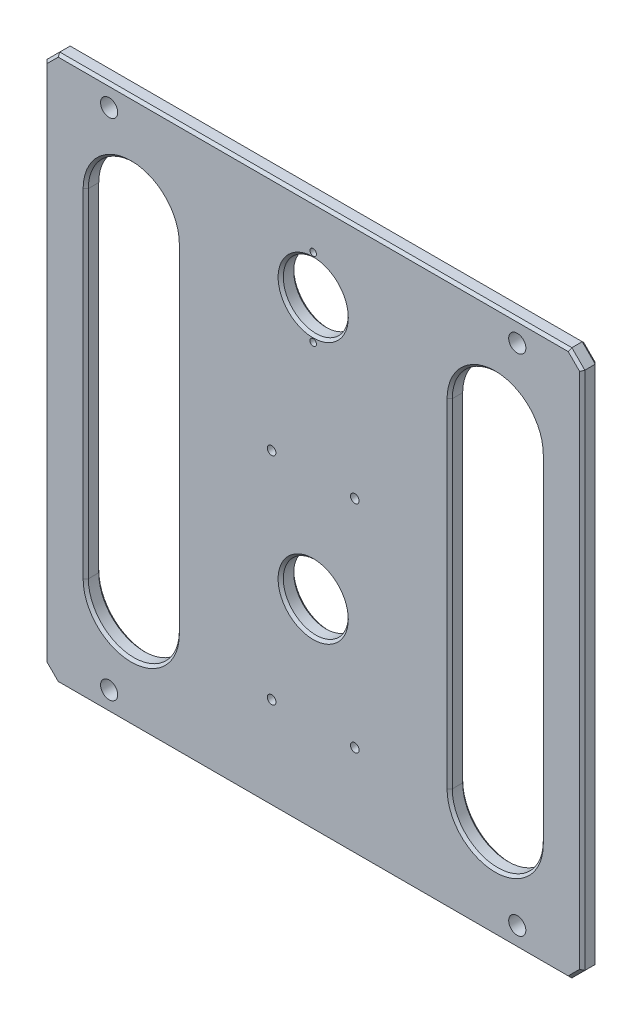
from build123d import *

# Parameters (mm, degrees)
SKETCH_1_W             = 207
SKETCH_1_H             = 210
EXTRUDE_1_DEPTH        = 6
SKETCH_2_R             = 3.3
CUT_EXTRUDE_1_DEPTH    = 148.557615866
CHAMFER_2_SIZE         = 5
CHAMFER_1_SIZE         = 1
HOLE_WIZARD_M4_1_D     = 3.3
HOLE_WIZARD_M4_1_DEPTH = 10.1
HOLE_WIZARD_M4_1_TIP   = 0.991420021
HOLE_WIZARD_M3_1_D     = 2.5
HOLE_WIZARD_M3_1_DEPTH = 7.5
HOLE_WIZARD_M3_1_TIP   = 0.751075774
SKETCH_7_R             = 12.5
CUT_EXTRUDE_2_DEPTH    = 148.557615866
SKETCH_8_R             = 12.5
CUT_EXTRUDE_3_DEPTH    = 148.557615866
CUT_EXTRUDE_4_DEPTH    = 148.557615866
CHAMFER_3_SIZE         = 1


with BuildPart() as part:
    # 草图1 → 凸台-拉伸1 (new body)
    with BuildSketch(Plane.XY):
        Rectangle(SKETCH_1_W, SKETCH_1_H)
    extrude(amount=EXTRUDE_1_DEPTH)

    # 草图2 → 切除-拉伸1 (cut, through all)
    with BuildSketch(Plane.XY.offset(6)):
        with Locations((-78.5, 97)):
            Circle(SKETCH_2_R)
        with Locations((78.5, 97)):
            Circle(SKETCH_2_R)
        with Locations((-78.5, -97)):
            Circle(SKETCH_2_R)
        with Locations((78.5, -97)):
            Circle(SKETCH_2_R)
    extrude(amount=-CUT_EXTRUDE_1_DEPTH, mode=Mode.SUBTRACT)

    # 倒角2
    chamfer_2_edges = [part.edges().sort_by_distance(p)[0] for p in [
        (103.5, -105, 3),
        (-103.5, -105, 3),
        (-103.5, 105, 3),
        (103.5, 105, 3),
    ]]
    chamfer(chamfer_2_edges, length=CHAMFER_2_SIZE)

    # 倒角1
    chamfer_1_edges = [part.edges().sort_by_distance(p)[0] for p in [
        (0, -105, 0),
        (0, -105, 6),
        (103.5, 0, 0),
        (-103.5, 0, 0),
        (0, 105, 0),
        (101, 102.5, 0),
        (-101, 102.5, 0),
        (101, -102.5, 0),
        (-101, -102.5, 0),
        (-103.5, 0, 6),
        (103.5, 0, 6),
        (0, 105, 6),
        (101, 102.5, 6),
        (-101, 102.5, 6),
        (101, -102.5, 6),
        (-101, -102.5, 6),
    ]]
    chamfer(chamfer_1_edges, length=CHAMFER_1_SIZE)

    # M4 螺纹孔1
    with Locations(Plane(origin=(0, 0, 0), x_dir=(-1, 0, 0), z_dir=(0, 0, -1))):
        with Locations((-16, 14), (16, 14), (16, -69), (-16, -69)):
            Hole(HOLE_WIZARD_M4_1_D / 2, depth=HOLE_WIZARD_M4_1_DEPTH)
            with Locations((0, 0, -(HOLE_WIZARD_M4_1_DEPTH + HOLE_WIZARD_M4_1_TIP / 2))):  # 118° drill point
                Cone(0, HOLE_WIZARD_M4_1_D / 2, HOLE_WIZARD_M4_1_TIP, mode=Mode.SUBTRACT)

    # M3 螺纹孔1
    with Locations(Plane(origin=(0, 0, 0), x_dir=(-1, 0, 0), z_dir=(0, 0, -1))):
        with Locations((0, 58), (0, 88)):
            Hole(HOLE_WIZARD_M3_1_D / 2, depth=HOLE_WIZARD_M3_1_DEPTH)
            with Locations((0, 0, -(HOLE_WIZARD_M3_1_DEPTH + HOLE_WIZARD_M3_1_TIP / 2))):  # 118° drill point
                Cone(0, HOLE_WIZARD_M3_1_D / 2, HOLE_WIZARD_M3_1_TIP, mode=Mode.SUBTRACT)

    # 草图7 → 切除-拉伸2 (cut, through all)
    with BuildSketch(Plane(origin=(0, 0, 0), x_dir=(-1, 0, 0), z_dir=(0, 0, -1))):
        with Locations((0, 73)):
            Circle(SKETCH_7_R)
    extrude(amount=-CUT_EXTRUDE_2_DEPTH, mode=Mode.SUBTRACT)

    # 草图8 → 切除-拉伸3 (cut, through all)
    with BuildSketch(Plane(origin=(0, 0, 0), x_dir=(-1, 0, 0), z_dir=(0, 0, -1))):
        with Locations((0, -27.5)):
            Circle(SKETCH_8_R)
    extrude(amount=-CUT_EXTRUDE_3_DEPTH, mode=Mode.SUBTRACT)

    # 草图9 → 切除-拉伸4 (cut, through all)
    with BuildSketch(Plane(origin=(0, 0, 0), x_dir=(-1, 0, 0), z_dir=(0, 0, -1))):
        with BuildLine():
            Line((-87.5, -65), (-87.5, 65))
            ThreePointArc((-87.5, 65), (-70, 82.5), (-52.5, 65))
            Line((-52.5, 65), (-52.5, -65))
            ThreePointArc((-52.5, -65), (-70, -82.5), (-87.5, -65))
        make_face()
        with BuildLine():
            Line((52.5, -65), (52.5, 65))
            ThreePointArc((52.5, 65), (70, 82.5), (87.5, 65))
            Line((87.5, 65), (87.5, -65))
            ThreePointArc((87.5, -65), (70, -82.5), (52.5, -65))
        make_face()
    extrude(amount=-CUT_EXTRUDE_4_DEPTH, mode=Mode.SUBTRACT)

    # 倒角3
    chamfer_3_edges = [part.edges().sort_by_distance(p)[0] for p in [
        (12.5, 73, 6),
        (12.5, 73, 0),
        (12.5, -27.5, 6),
        (12.5, -27.5, 0),
        (70, -82.5, 6),
        (87.5, 0, 6),
        (70, 82.5, 6),
        (52.5, 0, 6),
        (70, -82.5, 0),
        (52.5, 0, 0),
        (70, 82.5, 0),
        (87.5, 0, 0),
        (-70, -82.5, 6),
        (-52.5, 0, 6),
        (-70, 82.5, 6),
        (-87.5, 0, 6),
        (-70, -82.5, 0),
        (-87.5, 0, 0),
        (-70, 82.5, 0),
        (-52.5, 0, 0),
    ]]
    chamfer(chamfer_3_edges, length=CHAMFER_3_SIZE)


solid = part.part
